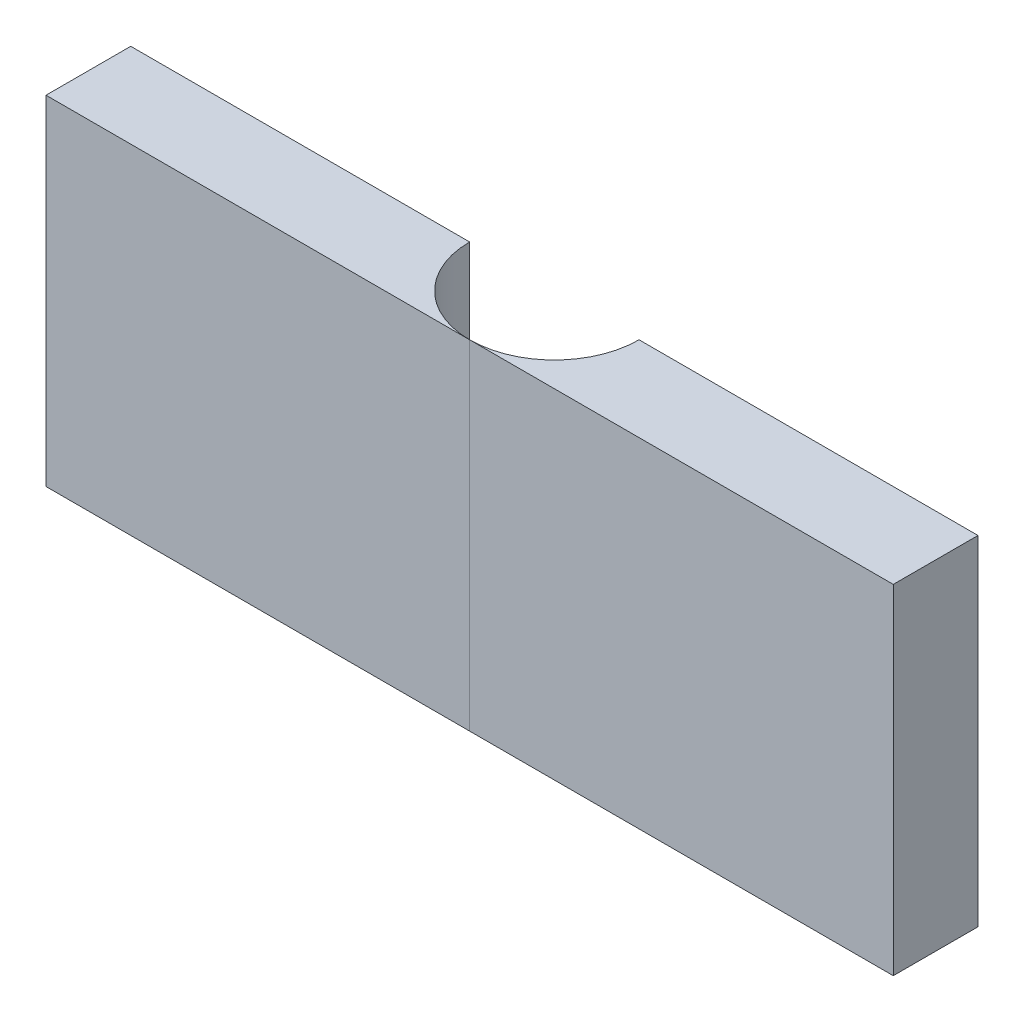
from build123d import *

# Parameters (mm, degrees)
SKETCH3_W           = 50
SKETCH3_H           = 5
BOSS_EXTRUDE2_DEPTH = 20
CUT_EXTRUDE2_DEPTH  = 20


with BuildPart() as part:
    # Sketch3 → Boss-Extrude2 (new body)
    with BuildSketch(Plane(origin=(0, 0, 0), x_dir=(1, 0, 0), z_dir=(0, 1, 0))):
        Rectangle(SKETCH3_W, SKETCH3_H)
    extrude(amount=-BOSS_EXTRUDE2_DEPTH)

    # Sketch5 → Cut-Extrude2 (cut)
    with BuildSketch(Plane(origin=(0, 0, 0), x_dir=(1, 0, 0), z_dir=(0, 1, 0))):
        with BuildLine():
            Line((-5, 2.5), (5, 2.5))
            ThreePointArc((5, 2.5), (0, -2.5), (-5, 2.5))
        make_face()
    extrude(amount=-CUT_EXTRUDE2_DEPTH, mode=Mode.SUBTRACT)


with BuildPart() as cut_extrude2_piece_1:
    # of the separate pieces the step leaves, piece 1, a body of its own (cut_extrude2_pieces)
    add(part.part.solids().sort_by_distance((5, 0, -2.5))[0])


with BuildPart() as cut_extrude2_piece_2:
    # of the separate pieces the step leaves, piece 2, a body of its own (cut_extrude2_pieces)
    add(part.part.solids().sort_by_distance((-25, 0, -2.5))[0])


solid = Compound([cut_extrude2_piece_1.part, cut_extrude2_piece_2.part])
